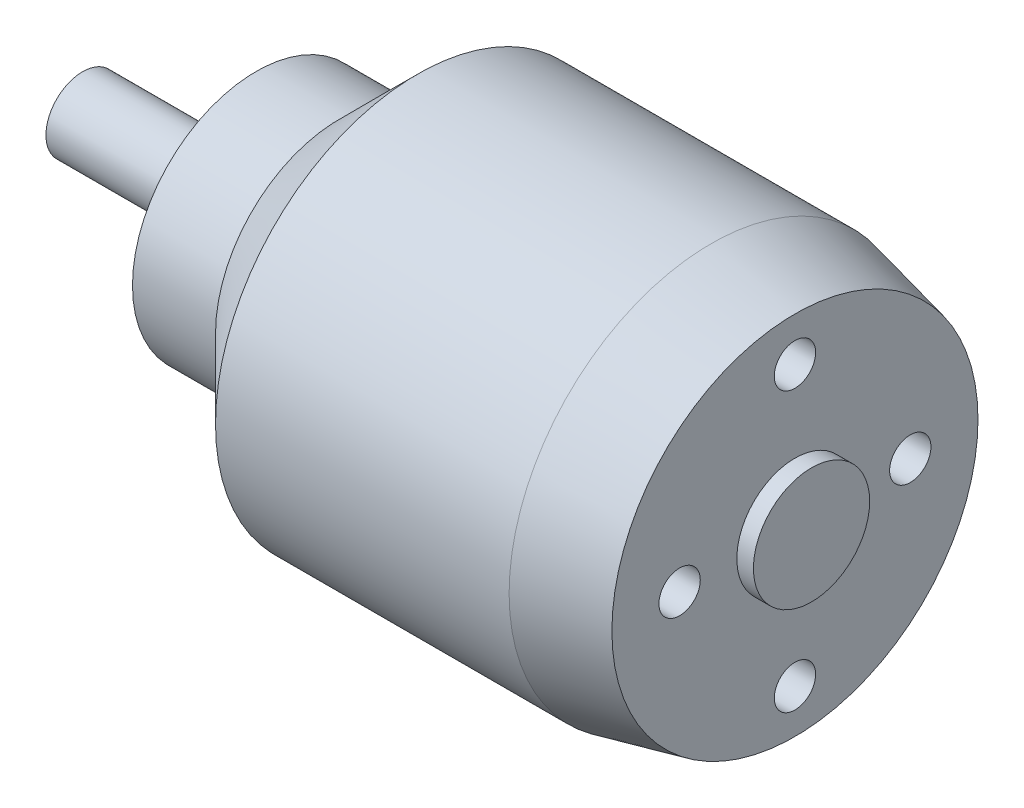
from build123d import *

# Parameters (mm, degrees)
SKETCH2_R          = 1.4224
CUT_EXTRUDE1_DEPTH = 2.54


with BuildPart() as part:
    # Sketch1 → Revolve1 (revolve)
    with BuildSketch(Plane(origin=(0, 0, 0), x_dir=(-1, 0, 0), z_dir=(0, 1, 0)), mode=Mode.PRIVATE) as revolve1_sk:
        Polygon((0, 0), (50.165, 0), (50.165, 2.5273), (38.227, 2.5273), (38.227, 8.509), (32.512, 8.509), (27.1145, 13.9065), (6.9088, 13.9065), (1.143, 12.5984), (1.143, 4.0005), (0, 4.0005), align=None)
    revolve(revolve1_sk.sketch.rotate(Axis((0, 0, 0), (-1, 0, 0)), 180), axis=Axis((0, 0, 0), (-1, 0, 0)))

    # Sketch2 → Cut-Extrude1 (cut)
    with BuildSketch(Plane.YZ.offset(-1.143)):
        with Locations(Location((0, 7.9375, 0), (0, 0, 270))):
            Circle(SKETCH2_R)
        with Locations(Location((-9.5885, 0, 0), (0, 0, 270))):
            Circle(SKETCH2_R)
        with Locations(Location((0, -7.9375, 0), (0, 0, 90))):
            Circle(SKETCH2_R)
        with Locations(Location((9.5885, 0, 0), (0, 0, 90))):
            Circle(SKETCH2_R)
    extrude(amount=-CUT_EXTRUDE1_DEPTH, mode=Mode.SUBTRACT)


solid = part.part
